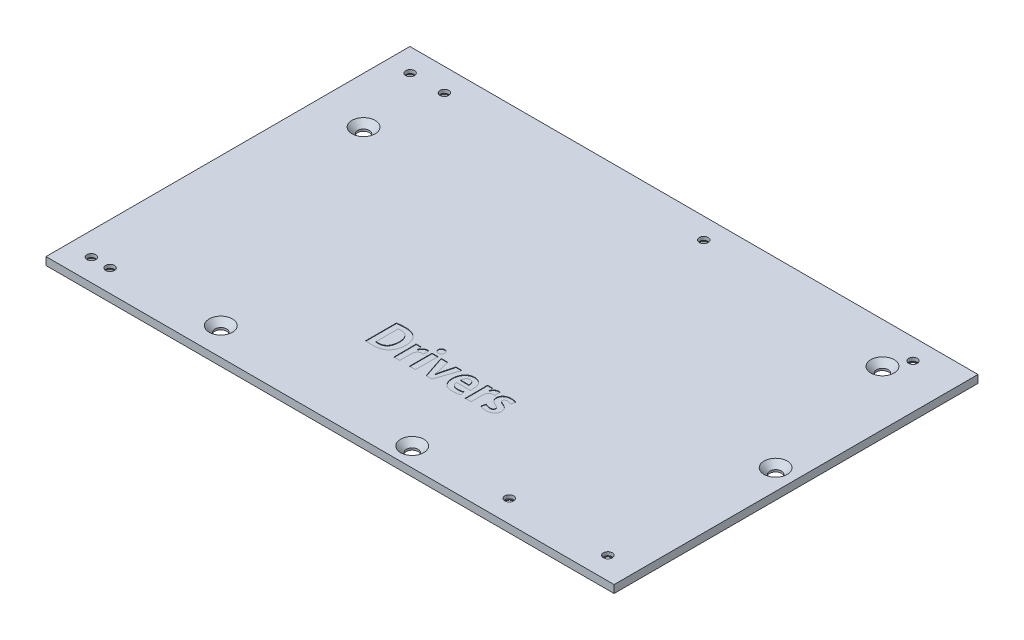
from build123d import *

# Parameters (mm, degrees)
SKETCH2_W                                    = 218.915
SKETCH2_H                                    = 140.238
SKETCH2_R                                    = 1.5
BOSS_EXTRUDE1_DEPTH                          = 3
SKETCH3_W                                    = 2.298644743
SKETCH3_H                                    = 8.669685468
CUT_EXTRUDE2_DEPTH                           = 0.2
CSK_FOR_M4_HEX_SOCKET_COUNTERSUNK_CA_2_COUNT = 2
CSK_FOR_M4_HEX_SOCKET_COUNTERSUNK_CA_2_PITCH = 77.101495492
CSK_FOR_M4_HEX_SOCKET_COUNTERSUNK_CA_3_COUNT = 2
CSK_FOR_M4_HEX_SOCKET_COUNTERSUNK_CA_3_PITCH = 101.438075265
CSK_FOR_M4_HEX_SOCKET_COUNTERSUNK_CA_4_COUNT = 2
CSK_FOR_M4_HEX_SOCKET_COUNTERSUNK_CA_4_PITCH = 181.312778626
CSK_FOR_M4_HEX_SOCKET_COUNTERSUNK_CA_5_COUNT = 2
CSK_FOR_M4_HEX_SOCKET_COUNTERSUNK_CA_5_PITCH = 165.396666202
CSK_FOR_M3_HEX_SOCKET_COUNTERSUNK_CA_2_COUNT = 2
CSK_FOR_M3_HEX_SOCKET_COUNTERSUNK_CA_2_PITCH = 80.645
CSK_FOR_M3_HEX_SOCKET_COUNTERSUNK_CA_3_COUNT = 2
CSK_FOR_M3_HEX_SOCKET_COUNTERSUNK_CA_3_PITCH = 179.704203913
CSK_FOR_M3_HEX_SOCKET_COUNTERSUNK_CA_4_COUNT = 2
CSK_FOR_M3_HEX_SOCKET_COUNTERSUNK_CA_4_PITCH = 192.912053019
CSK_FOR_M3_HEX_SOCKET_COUNTERSUNK_CA_5_COUNT = 2
CSK_FOR_M3_HEX_SOCKET_COUNTERSUNK_CA_5_PITCH = 223.135659815
CSK_FOR_M3_HEX_SOCKET_COUNTERSUNK_CA_6_COUNT = 2
CSK_FOR_M3_HEX_SOCKET_COUNTERSUNK_CA_6_PITCH = 229.163605531
CSK_FOR_M3_HEX_SOCKET_COUNTERSUNK_CA_7_COUNT = 2
CSK_FOR_M3_HEX_SOCKET_COUNTERSUNK_CA_7_PITCH = 127.747015621
CSK_FOR_M3_HEX_SOCKET_COUNTERSUNK_CA_8_COUNT = 2
CSK_FOR_M3_HEX_SOCKET_COUNTERSUNK_CA_8_PITCH = 123.850312878


with BuildPart() as part:
    # Sketch2 → Boss-Extrude1 (new body)
    with BuildSketch(Plane(origin=(0, 0, 0), x_dir=(1, 0, 0), z_dir=(0, 1, 0))):
        Rectangle(SKETCH2_W, SKETCH2_H)
        with Locations(Location((-87.3095, 61.251, 0), (0, 0, 270))):
            Circle(SKETCH2_R, mode=Mode.SUBTRACT)
        with Locations(Location((-100.5175, 61.251, 0), (0, 0, 270))):
            Circle(SKETCH2_R, mode=Mode.SUBTRACT)
        with Locations(Location((11.7475, 62.141, 0), (0, 0, 270))):
            Circle(SKETCH2_R, mode=Mode.SUBTRACT)
        with Locations(Location((92.3925, 62.141, 0), (0, 0, 270))):
            Circle(SKETCH2_R, mode=Mode.SUBTRACT)
        with Locations(Location((60.4925, -61.559, 0), (0, 0, 270))):
            Circle(SKETCH2_R, mode=Mode.SUBTRACT)
        with Locations(Location((98.4925, -61.559, 0), (0, 0, 270))):
            Circle(SKETCH2_R, mode=Mode.SUBTRACT)
        with Locations(Location((-93.3165, -61.559, 0), (0, 0, 270))):
            Circle(SKETCH2_R, mode=Mode.SUBTRACT)
        with Locations(Location((-100.5175, -61.559, 0), (0, 0, 270))):
            Circle(SKETCH2_R, mode=Mode.SUBTRACT)
    extrude(amount=BOSS_EXTRUDE1_DEPTH)

    # Sketch3 → Cut-Extrude2 (cut)
    # profile 1 of 8: a face of its own
    with BuildSketch(Plane(origin=(0, 3, 0), x_dir=(1, 0, 0), z_dir=(0, 1, 0))):
        with BuildLine():
            add(Edge.make_bspline(
                [(-19.773523186, -36.616542613), (-19.692877975, -36.627718187), (-19.522806263, -36.651286219), (-19.25573132, -36.680092345), (-18.964467685, -36.704316718), (-18.650043814, -36.727551671), (-18.312098436, -36.745031954), (-17.950829239, -36.758765798), (-17.566907783, -36.767099749), (-17.302934654, -36.771224044), (-17.167186135, -36.773344968)],
                knots=[0, 0, 0, 0, 0.747798485, 1.577023202, 2.466955376, 3.432305679, 4.472841868, 5.575028817, 6.752955478, 8, 8, 8, 8], degree=3))
            add(Edge.make_bspline(
                [(-17.167186135, -36.773344968), (-16.914385162, -36.769231623), (-16.421404683, -36.761210297), (-15.703937253, -36.692360594), (-15.028021379, -36.581053654), (-14.39671948, -36.420911951), (-13.809487851, -36.217118709), (-13.273107567, -35.961121892), (-12.780095814, -35.666285148), (-12.492354578, -35.424342424), (-12.350444054, -35.305019176)],
                knots=[0, 0, 0, 0, 1.17842423, 2.298013867, 3.356996017, 4.369259479, 5.331192529, 6.249700563, 7.136773321, 8, 8, 8, 8], degree=3))
            add(Edge.make_bspline(
                [(-12.350444054, -35.305019176), (-12.291009989, -35.251375231), (-12.170198305, -35.142333128), (-11.996947178, -34.963094353), (-11.833799267, -34.762640168), (-11.670548315, -34.548605269), (-11.52193997, -34.310900638), (-11.370031425, -34.060409926), (-11.229569923, -33.788861384), (-11.092242535, -33.500083707), (-10.964046665, -33.191119765), (-10.857664358, -32.856576209), (-10.760957933, -32.501605914), (-10.686544786, -32.122398597), (-10.621184629, -31.721288328), (-10.57901856, -31.296556848), (-10.544770288, -30.849283167), (-10.538950359, -30.543401316), (-10.535964416, -30.38646714)],
                knots=[0, 0, 0, 0, 0.711529635, 1.446327024, 2.212730038, 3.007707617, 3.836959069, 4.702581573, 5.611055214, 6.552559085, 7.54462654, 8.581167827, 9.670545423, 10.812911411, 12.014096724, 13.281372547, 14.605194915, 16, 16, 16, 16], degree=3))
            add(Edge.make_bspline(
                [(-10.535964416, -30.38646714), (-10.538011906, -30.252955959), (-10.542017263, -29.991777627), (-10.564308228, -29.607469941), (-10.603487222, -29.238529386), (-10.653815105, -28.884056095), (-10.722820273, -28.545341196), (-10.803723461, -28.222041701), (-10.898002884, -27.913287096), (-11.009692681, -27.620624466), (-11.134506232, -27.342386464), (-11.26971765, -27.076436513), (-11.419718697, -26.825524987), (-11.580235701, -26.586751272), (-11.754055639, -26.362912923), (-11.941544027, -26.154389234), (-12.13731418, -25.955564094), (-12.279344602, -25.835640391), (-12.350444054, -25.775607411)],
                knots=[0, 0, 0, 0, 1.250196122, 2.445668869, 3.60292861, 4.723409941, 5.796680955, 6.837975795, 7.843086112, 8.817515314, 9.76895262, 10.69744629, 11.609358382, 12.504409608, 13.39005195, 14.260302496, 15.129119398, 16, 16, 16, 16], degree=3))
            add(Edge.make_bspline(
                [(-12.350444054, -25.775607411), (-12.478022477, -25.673834773), (-12.735842559, -25.468164966), (-13.168123313, -25.21065108), (-13.638991157, -24.994028484), (-14.150475885, -24.813226886), (-14.708529552, -24.677162854), (-15.316536923, -24.577813729), (-15.97677705, -24.520068229), (-16.434793544, -24.512535519), (-16.671711022, -24.508639085)],
                knots=[0, 0, 0, 0, 0.850789701, 1.719339872, 2.61723906, 3.551911928, 4.545442216, 5.610282156, 6.763874371, 8, 8, 8, 8], degree=3))
            add(Edge.make_bspline(
                [(-16.671711022, -24.508639085), (-16.957619842, -24.511218411), (-17.515564562, -24.516251907), (-18.201827187, -24.560458739), (-18.72440942, -24.607375564), (-19.091390457, -24.654380799), (-19.440278129, -24.702376655), (-19.665789549, -24.742474773), (-19.77578342, -24.762032751)],
                knots=[0, 0, 0, 0, 1.650018419, 3.219974348, 3.967566001, 4.678084243, 5.355231624, 6, 6, 6, 6], degree=3))
            Line((-19.77578342, -24.762032751), (-19.773523186, -36.616542613))
        make_face()
        with BuildLine():
            add(Edge.make_bspline(
                [(-17.474878443, -26.437305835), (-17.406378443, -26.424755637), (-17.255763214, -26.397160733), (-17.006158209, -26.372950406), (-16.714300917, -26.351102696), (-16.505098902, -26.347608369), (-16.393430479, -26.345743158)],
                knots=[0, 0, 0, 0, 0.76869223, 1.690171609, 2.76705349, 4, 4, 4, 4], degree=3))
            add(Edge.make_bspline(
                [(-16.393430479, -26.345743158), (-16.262822839, -26.348645857), (-16.008241503, -26.35430382), (-15.637603811, -26.402275663), (-15.289663326, -26.482495779), (-14.961073349, -26.58793409), (-14.658621154, -26.737249919), (-14.373925416, -26.909325668), (-14.114290469, -27.118793222), (-13.875497375, -27.356563486), (-13.661383871, -27.627933223), (-13.475271367, -27.932490253), (-13.321129629, -28.270182199), (-13.186494999, -28.636642324), (-13.091451193, -29.038247943), (-13.015258486, -29.46933232), (-12.970788235, -29.933076875), (-12.963043213, -30.252892009), (-12.959041339, -30.418141348)],
                knots=[0, 0, 0, 0, 1.034636826, 2.016721417, 2.954616098, 3.861659027, 4.743652532, 5.62095741, 6.492606741, 7.379948462, 8.28614458, 9.224914536, 10.200706863, 11.223314941, 12.31319917, 13.465574242, 14.690455408, 16, 16, 16, 16], degree=3))
            add(Edge.make_bspline(
                [(-12.959041339, -30.418141348), (-12.963586993, -30.608289612), (-12.972369525, -30.975669764), (-13.021555536, -31.507246386), (-13.103160939, -31.99835502), (-13.209673435, -32.451808795), (-13.34982481, -32.864735442), (-13.519158035, -33.239658321), (-13.720873969, -33.573564213), (-13.951345508, -33.868863005), (-14.208041835, -34.124809882), (-14.486178225, -34.345844089), (-14.784267569, -34.53371057), (-15.106282871, -34.683259032), (-15.448733003, -34.798084151), (-15.811611775, -34.880353041), (-16.196167513, -34.925669376), (-16.459678485, -34.928170942), (-16.594787945, -34.929453565)],
                knots=[0, 0, 0, 0, 1.382790342, 2.671650606, 3.877892401, 5.000458499, 6.054825918, 7.043745429, 7.986092149, 8.88452668, 9.760866288, 10.615577842, 11.46308158, 12.316807429, 13.190810493, 14.084799087, 15.018022824, 16, 16, 16, 16], degree=3))
            add(Edge.make_bspline(
                [(-16.594787945, -34.929453565), (-16.675494433, -34.931177238), (-16.831684566, -34.934513037), (-17.05876175, -34.923515129), (-17.271850594, -34.909690472), (-17.408591602, -34.891001807), (-17.474878443, -34.881942253)],
                knots=[0, 0, 0, 0, 1.0974001, 2.123783006, 3.090481336, 4, 4, 4, 4], degree=3))
            Line((-17.474878443, -34.881942253), (-17.474878443, -26.437305835))
        make_face(mode=Mode.SUBTRACT)
    # profile 2 of 8: a face of its own
    with BuildSketch(Plane(origin=(0, 3, 0), x_dir=(1, 0, 0), z_dir=(0, 1, 0))):
        with BuildLine():
            Line((-6.910140303, -29.477541535), (-7.00333353, -27.967915103))
            Line((-7.00333353, -27.967915103), (-8.976347706, -27.967915103))
            add(Edge.make_bspline(
                [(-8.976347706, -27.967915103), (-8.967807583, -28.166237182), (-8.949952024, -28.580885961), (-8.932429902, -29.231030361), (-8.921707799, -29.936210261), (-8.917985113, -30.424925331), (-8.916054914, -30.678322343)],
                knots=[0, 0, 0, 0, 0.878570808, 1.836902451, 2.878441676, 4, 4, 4, 4], degree=3))
            Line((-8.916054914, -30.678322343), (-8.91379468, -36.637600571))
            Line((-8.91379468, -36.637600571), (-6.615149936, -36.637600571))
            Line((-6.615149936, -36.637600571), (-6.615149936, -32.154781001))
            add(Edge.make_bspline(
                [(-6.615149936, -32.154781001), (-6.612567299, -32.06603014), (-6.607534868, -31.893093516), (-6.580570195, -31.643031511), (-6.53756993, -31.410055187), (-6.479656664, -31.194647687), (-6.404326872, -30.997402066), (-6.317121503, -30.815984137), (-6.209631737, -30.655335133), (-6.088897361, -30.511200992), (-5.955754651, -30.385775884), (-5.813839618, -30.275036985), (-5.662670429, -30.18269562), (-5.501818697, -30.10704936), (-5.332108459, -30.047786128), (-5.152773536, -30.008415697), (-4.96513153, -29.981622776), (-4.836969137, -29.980039228), (-4.771258534, -29.979227321)],
                knots=[0, 0, 0, 0, 1.320531847, 2.573139202, 3.737200453, 4.842238086, 5.886183057, 6.874635172, 7.829930864, 8.753606734, 9.666246489, 10.545948826, 11.42722372, 12.29547608, 13.186057347, 14.095104019, 15.023333894, 16, 16, 16, 16], degree=3))
            add(Edge.make_bspline(
                [(-4.771258534, -29.979227321), (-4.663932339, -29.97927829), (-4.464392632, -29.979373051), (-4.267312688, -30.010220584), (-4.176235909, -30.024476189)],
                knots=[0, 0, 0, 0, 1.075737725, 2, 2, 2, 2], degree=3))
            Line((-4.176235909, -30.024476189), (-4.175581922, -27.823118723))
            add(Edge.make_bspline(
                [(-4.175581922, -27.823118723), (-4.254226195, -27.826187901), (-4.426352232, -27.832905304), (-4.598551486, -27.828029318), (-4.692073013, -27.825381167)],
                knots=[0, 0, 0, 0, 0.913798691, 2, 2, 2, 2], degree=3))
            add(Edge.make_bspline(
                [(-4.692073013, -27.825381167), (-4.797309999, -27.824923275), (-5.008823265, -27.824002968), (-5.323062876, -27.900571031), (-5.63331425, -28.026632515), (-5.934312443, -28.210237683), (-6.218591484, -28.446663805), (-6.465875945, -28.742948366), (-6.685024841, -29.086945377), (-6.792480229, -29.345303083), (-6.848181611, -29.479227321)],
                knots=[0, 0, 0, 0, 0.866819651, 1.742199811, 2.650674065, 3.626487561, 4.643864205, 5.691614162, 6.803407804, 8, 8, 8, 8], degree=3))
            Line((-6.848181611, -29.479227321), (-6.910140303, -29.477541535))
        make_face()
    # profile 3 of 8: a face of its own
    with BuildSketch(Plane(origin=(0, 3, 0), x_dir=(1, 0, 0), z_dir=(0, 1, 0))):
        with BuildLine():
            add(Edge.make_bspline(
                [(-0.388905592, -25.569815644), (-0.394259293, -25.483437705), (-0.404600745, -25.316586149), (-0.467899937, -25.078654517), (-0.576592287, -24.868996254), (-0.723204659, -24.68856952), (-0.902804026, -24.539255263), (-1.116243654, -24.431870706), (-1.358574959, -24.364836616), (-1.530231343, -24.355258716), (-1.619674823, -24.350268045)],
                knots=[0, 0, 0, 0, 1.067678627, 2.062376614, 3.016841452, 3.964320136, 4.917692493, 5.880446744, 6.895583054, 8, 8, 8, 8], degree=3))
            add(Edge.make_bspline(
                [(-1.619674823, -24.350268045), (-1.705368303, -24.35532102), (-1.871100673, -24.365093544), (-2.106325688, -24.432783306), (-2.316804828, -24.539713645), (-2.495380587, -24.689378459), (-2.64573226, -24.867475824), (-2.74912825, -25.080207675), (-2.820846835, -25.316320096), (-2.82990847, -25.484688216), (-2.83460695, -25.571987502)],
                knots=[0, 0, 0, 0, 1.066831069, 2.06326596, 3.025668899, 3.98697027, 4.948271641, 5.90639895, 6.914462685, 8, 8, 8, 8], degree=3))
            add(Edge.make_bspline(
                [(-2.83460695, -25.571987502), (-2.829275482, -25.656859798), (-2.81893306, -25.821502092), (-2.754666743, -26.056289662), (-2.649049038, -26.266802451), (-2.50261031, -26.448556623), (-2.323510374, -26.599257612), (-2.11316625, -26.710037688), (-1.874609087, -26.77605133), (-1.706818409, -26.787671776), (-1.619674823, -26.793706959)],
                knots=[0, 0, 0, 0, 1.057718482, 2.051849729, 3.010193927, 3.97308998, 4.940607778, 5.907577615, 6.913281758, 8, 8, 8, 8], degree=3))
            add(Edge.make_bspline(
                [(-1.619674823, -26.793706959), (-1.533303063, -26.789337671), (-1.366370926, -26.780893076), (-1.129011428, -26.716618964), (-0.918691152, -26.609439958), (-0.733396684, -26.467248671), (-0.583623243, -26.28687097), (-0.471548761, -26.075643017), (-0.406551526, -25.832814344), (-0.394952015, -25.661360468), (-0.388905592, -25.571987502)],
                knots=[0, 0, 0, 0, 1.065625004, 2.059551157, 3.009038306, 3.964579149, 4.923155116, 5.881188186, 6.895536802, 8, 8, 8, 8], degree=3))
            Line((-0.388905592, -25.571987502), (-0.388905592, -25.569815644))
        make_face()
    # profile 4 of 8: a face of its own
    with BuildSketch(Plane(origin=(0, 3, 0), x_dir=(1, 0, 0), z_dir=(0, 1, 0))):
        with Locations((-1.683024344, -32.302757837)):
            Rectangle(SKETCH3_W, SKETCH3_H)
    # profile 5 of 8: a face of its own
    with BuildSketch(Plane(origin=(0, 3, 0), x_dir=(1, 0, 0), z_dir=(0, 1, 0))):
        with BuildLine():
            add(Edge.make_bspline(
                [(5.263707707, -32.170346346), (5.174544252, -32.532857608), (4.996559536, -33.25648888), (4.852612705, -33.987651863), (4.780777666, -34.352530488)],
                knots=[0, 0, 0, 0, 1.001922598, 2, 2, 2, 2], degree=3))
            Line((4.780777666, -34.352530488), (4.734711312, -34.352530488))
            add(Edge.make_bspline(
                [(4.734711312, -34.352530488), (4.662135966, -33.985450573), (4.51653432, -33.249009854), (4.339937691, -32.519380193), (4.251365901, -32.153435465)],
                knots=[0, 0, 0, 0, 0.99690282, 2, 2, 2, 2], degree=3))
            Line((4.251365901, -32.153435465), (3.116604695, -27.967915103))
            Line((3.116604695, -27.967915103), (0.642768616, -27.967915103))
            Line((0.642768616, -27.967915103), (3.552248784, -36.624023701))
            Line((3.552248784, -36.624023701), (5.777145383, -36.624023701))
            Line((5.777145383, -36.624023701), (8.733264144, -27.967915103))
            Line((8.733264144, -27.967915103), (6.35281793, -27.967915103))
            Line((6.35281793, -27.967915103), (5.263707707, -32.170346346))
        make_face()
    # profile 6 of 8: a face of its own
    with BuildSketch(Plane(origin=(0, 3, 0), x_dir=(1, 0, 0), z_dir=(0, 1, 0))):
        with BuildLine():
            add(Edge.make_bspline(
                [(16.918402277, -33.017691069), (16.928189436, -32.952156016), (16.948718864, -32.814690472), (16.968262665, -32.597969584), (16.979679358, -32.36321716), (16.979806885, -32.2009608), (16.979872688, -32.11723637)],
                knots=[0, 0, 0, 0, 0.879814102, 1.845487553, 2.888269607, 4, 4, 4, 4], degree=3))
            add(Edge.make_bspline(
                [(16.979872688, -32.11723637), (16.976119543, -31.945925705), (16.968829845, -31.613190649), (16.920591889, -31.130159003), (16.845341941, -30.679099292), (16.738515355, -30.260848974), (16.605919819, -29.873945323), (16.443556394, -29.519082674), (16.249761599, -29.198064239), (16.030366684, -28.909066899), (15.783806811, -28.6547821), (15.517021585, -28.430448879), (15.224500694, -28.246203029), (14.914790428, -28.088182308), (14.579747264, -27.973169987), (14.225004441, -27.885368471), (13.84773613, -27.836559436), (13.589354275, -27.829162889), (13.457248254, -27.825381167)],
                knots=[0, 0, 0, 0, 1.306657607, 2.537908493, 3.699270234, 4.791739878, 5.826909547, 6.815290999, 7.762398175, 8.68170366, 9.57675071, 10.459137333, 11.333612719, 12.208315133, 13.105301175, 14.028952094, 14.992238463, 16, 16, 16, 16], degree=3))
            add(Edge.make_bspline(
                [(13.457248254, -27.825381167), (13.300111528, -27.833746026), (12.994075403, -27.850037246), (12.549666901, -27.923141971), (12.134174481, -28.036077491), (11.746100423, -28.18729889), (11.388847763, -28.381266962), (11.059663698, -28.61325228), (10.761842986, -28.887713915), (10.493999923, -29.198181248), (10.254706306, -29.536311931), (10.049631485, -29.898432442), (9.870578107, -30.276928095), (9.729880054, -30.677283391), (9.615600762, -31.094403732), (9.535097821, -31.530318301), (9.483894714, -31.984803058), (9.476734695, -32.294321722), (9.473085358, -32.452077999)],
                knots=[0, 0, 0, 0, 1.102218766, 2.14665769, 3.149339139, 4.115122672, 5.058741015, 5.991431174, 6.93040496, 7.889527187, 8.860316271, 9.828598601, 10.80279168, 11.790822775, 12.798603709, 13.831085196, 14.894541863, 16, 16, 16, 16], degree=3))
            add(Edge.make_bspline(
                [(9.473085358, -32.452077999), (9.476217732, -32.615912166), (9.482313122, -32.934722483), (9.539539249, -33.398878983), (9.623065534, -33.836940738), (9.744166177, -34.247705858), (9.893736511, -34.633084918), (10.084655779, -34.987702777), (10.303853411, -35.318233213), (10.558024322, -35.619595717), (10.843492743, -35.890981573), (11.163256094, -36.124288989), (11.510981573, -36.324945345), (11.890283835, -36.487789611), (12.29870792, -36.617022179), (12.738439374, -36.708122707), (13.207497116, -36.76850388), (13.530960597, -36.7776817), (13.697067258, -36.782394741)],
                knots=[0, 0, 0, 0, 1.145056205, 2.228202694, 3.265464393, 4.259985655, 5.218630789, 6.1504322, 7.070355583, 7.987236137, 8.901139799, 9.817656355, 10.748382851, 11.702521477, 12.69814653, 13.738580065, 14.838703788, 16, 16, 16, 16], degree=3))
            add(Edge.make_bspline(
                [(13.697067258, -36.782394741), (13.834362502, -36.780561917), (14.104653716, -36.77695366), (14.503929395, -36.751246867), (14.88978511, -36.71149055), (15.260247633, -36.65439855), (15.613407546, -36.585886651), (15.943780781, -36.499651921), (16.252758955, -36.40347907), (16.446405193, -36.325160817), (16.540958661, -36.286919628)],
                knots=[0, 0, 0, 0, 1.134244074, 2.232970358, 3.304290349, 4.337913843, 5.328893587, 6.274899807, 7.157669119, 8, 8, 8, 8], degree=3))
            Line((16.540958661, -36.286919628), (16.214680734, -34.709254187))
            add(Edge.make_bspline(
                [(16.214680734, -34.709254187), (16.063451137, -34.761173166), (15.748092141, -34.869439785), (15.234204296, -34.969539678), (14.669611567, -35.041705983), (14.274248983, -35.055661407), (14.068107982, -35.062937728)],
                knots=[0, 0, 0, 0, 0.87704573, 1.828902987, 2.867995791, 4, 4, 4, 4], degree=3))
            add(Edge.make_bspline(
                [(14.068107982, -35.062937728), (13.98736869, -35.062601527), (13.828625884, -35.061940516), (13.595003007, -35.040893477), (13.370241742, -35.00535856), (13.155203904, -34.952214582), (12.948032858, -34.888704354), (12.752901226, -34.802221919), (12.564680871, -34.706561543), (12.387459748, -34.593085987), (12.223811185, -34.463122154), (12.080508593, -34.311515539), (11.953959314, -34.143243622), (11.851594987, -33.953841177), (11.762951156, -33.747868562), (11.700279944, -33.521496478), (11.650538854, -33.277425796), (11.63646644, -33.107676219), (11.629193955, -33.019951303)],
                knots=[0, 0, 0, 0, 1.082387839, 2.128099923, 3.142379076, 4.130968346, 5.096948731, 6.043838086, 6.989267902, 7.926329474, 8.861424035, 9.784240628, 10.716760901, 11.676526397, 12.664598162, 13.717669873, 14.820514169, 16, 16, 16, 16], degree=3))
            Line((11.629193955, -33.019951303), (16.918402277, -33.017691069))
        make_face()
        with BuildLine():
            add(Edge.make_bspline(
                [(11.629193955, -31.443028226), (11.640668798, -31.327213873), (11.663732567, -31.094433722), (11.750854707, -30.750537416), (11.888298769, -30.415897749), (12.031584887, -30.144852433), (12.169487965, -29.940150822), (12.291318297, -29.804783989), (12.427228032, -29.688618834), (12.578158005, -29.593816265), (12.740980638, -29.515164043), (12.919056847, -29.457073283), (13.110884515, -29.415457618), (13.244368539, -29.405248796), (13.312451874, -29.4000418)],
                knots=[0, 0, 0, 0, 1.434019087, 2.882295425, 4.35559367, 5.887023456, 6.655881304, 7.39355732, 8.125995891, 8.853635031, 9.585837332, 10.350577125, 11.158714241, 12, 12, 12, 12], degree=3))
            add(Edge.make_bspline(
                [(13.312451874, -29.4000418), (13.381973348, -29.405617553), (13.516544143, -29.416410382), (13.710424521, -29.451996646), (13.888297422, -29.507652411), (14.047497766, -29.586403051), (14.193133279, -29.67896071), (14.320042095, -29.793896471), (14.432526384, -29.925480533), (14.553724358, -30.126845241), (14.672972868, -30.396322113), (14.780871876, -30.733276701), (14.834852023, -31.085273644), (14.836504212, -31.322966699), (14.837338751, -31.443028226)],
                knots=[0, 0, 0, 0, 0.873766243, 1.691325154, 2.465551819, 3.201135629, 3.9116346, 4.62125276, 5.338946048, 6.073375047, 7.558144449, 9.023104326, 10.496335382, 12, 12, 12, 12], degree=3))
            Line((14.837338751, -31.443028226), (11.629193955, -31.443028226))
        make_face(mode=Mode.SUBTRACT)
    # profile 7 of 8: a face of its own
    with BuildSketch(Plane(origin=(0, 3, 0), x_dir=(1, 0, 0), z_dir=(0, 1, 0))):
        with BuildLine():
            Line((20.601171914, -29.477541535), (20.507978687, -27.967915103))
            Line((20.507978687, -27.967915103), (18.534964512, -27.967915103))
            add(Edge.make_bspline(
                [(18.534964512, -27.967915103), (18.543504635, -28.166237182), (18.561360194, -28.580885961), (18.578882315, -29.231030361), (18.589604418, -29.936210261), (18.593327104, -30.424925331), (18.595257304, -30.678322343)],
                knots=[0, 0, 0, 0, 0.878570808, 1.836902451, 2.878441676, 4, 4, 4, 4], degree=3))
            Line((18.595257304, -30.678322343), (18.597517538, -36.637600571))
            Line((18.597517538, -36.637600571), (20.896162281, -36.637600571))
            Line((20.896162281, -36.637600571), (20.896162281, -32.154781001))
            add(Edge.make_bspline(
                [(20.896162281, -32.154781001), (20.898744918, -32.06603014), (20.903777349, -31.893093516), (20.930742022, -31.643031511), (20.973742287, -31.410055187), (21.031655553, -31.194647687), (21.106985345, -30.997402066), (21.194190714, -30.815984137), (21.30168048, -30.655335133), (21.422414856, -30.511200992), (21.555557566, -30.385775884), (21.6974726, -30.275036985), (21.848641788, -30.18269562), (22.00949352, -30.10704936), (22.179203758, -30.047786128), (22.358538681, -30.008415697), (22.546180688, -29.981622776), (22.67434308, -29.980039228), (22.740053684, -29.979227321)],
                knots=[0, 0, 0, 0, 1.320531847, 2.573139202, 3.737200453, 4.842238086, 5.886183057, 6.874635172, 7.829930864, 8.753606734, 9.666246489, 10.545948826, 11.42722372, 12.29547608, 13.186057347, 14.095104019, 15.023333894, 16, 16, 16, 16], degree=3))
            add(Edge.make_bspline(
                [(22.740053684, -29.979227321), (22.847379878, -29.97927829), (23.046919585, -29.979373051), (23.243999529, -30.010220584), (23.335076308, -30.024476189)],
                knots=[0, 0, 0, 0, 1.075737725, 2, 2, 2, 2], degree=3))
            Line((23.335076308, -30.024476189), (23.335730296, -27.823118723))
            add(Edge.make_bspline(
                [(23.335730296, -27.823118723), (23.257086022, -27.826187901), (23.084959985, -27.832905304), (22.912760731, -27.828029318), (22.819239204, -27.825381167)],
                knots=[0, 0, 0, 0, 0.913798691, 2, 2, 2, 2], degree=3))
            add(Edge.make_bspline(
                [(22.819239204, -27.825381167), (22.714002219, -27.824923275), (22.502488952, -27.824002968), (22.188249342, -27.900571031), (21.877997968, -28.026632515), (21.576999775, -28.210237683), (21.292720733, -28.446663805), (21.045436273, -28.742948366), (20.826287377, -29.086945377), (20.718831988, -29.345303083), (20.663130607, -29.479227321)],
                knots=[0, 0, 0, 0, 0.866819651, 1.742199811, 2.650674065, 3.626487561, 4.643864205, 5.691614162, 6.803407804, 8, 8, 8, 8], degree=3))
            Line((20.663130607, -29.479227321), (20.601171914, -29.477541535))
        make_face()
    # profile 8 of 8: a face of its own
    with BuildSketch(Plane(origin=(0, 3, 0), x_dir=(1, 0, 0), z_dir=(0, 1, 0))):
        with BuildLine():
            add(Edge.make_bspline(
                [(24.186075407, -36.183664715), (24.261978717, -36.228195155), (24.418694754, -36.320136259), (24.678502661, -36.426147782), (24.958310843, -36.528395728), (25.26125954, -36.611745936), (25.581123352, -36.682697082), (25.913798948, -36.731707941), (26.256857784, -36.76149949), (26.488862308, -36.76635609), (26.606569521, -36.768820081)],
                knots=[0, 0, 0, 0, 0.83761196, 1.729400559, 2.668252281, 3.676193025, 4.720774259, 5.789020092, 6.87826204, 8, 8, 8, 8], degree=3))
            add(Edge.make_bspline(
                [(26.606569521, -36.768820081), (26.740152556, -36.765307164), (26.999573731, -36.758485001), (27.37675265, -36.719344303), (27.730049613, -36.65929521), (28.059461608, -36.576058189), (28.364664535, -36.469433525), (28.646331621, -36.340951145), (28.90375376, -36.188926572), (29.13579966, -36.014054858), (29.340606049, -35.819220409), (29.522829292, -35.610698645), (29.671715727, -35.381561243), (29.797482993, -35.138781396), (29.895428243, -34.878325554), (29.964461711, -34.601977075), (30.008965257, -34.309451601), (30.015158553, -34.109105875), (30.018334227, -34.006376642)],
                knots=[0, 0, 0, 0, 1.294448016, 2.513846346, 3.670773034, 4.764320961, 5.802019244, 6.79930617, 7.759297293, 8.693207164, 9.608170021, 10.494314425, 11.369880064, 12.249036721, 13.139389433, 14.05924175, 15.004857203, 16, 16, 16, 16], degree=3))
            add(Edge.make_bspline(
                [(30.018334227, -34.006376642), (30.018145025, -33.933926905), (30.017773476, -33.791652371), (29.994532109, -33.581012752), (29.952360353, -33.378226828), (29.900926388, -33.179711724), (29.822593529, -32.991802497), (29.736642293, -32.807520541), (29.628682828, -32.63225729), (29.502898561, -32.464881238), (29.363595588, -32.301840026), (29.205895729, -32.147017015), (29.031208926, -32.000571042), (28.840426796, -31.859416469), (28.631952081, -31.726761264), (28.407114687, -31.599506987), (28.165228366, -31.479815502), (27.996074281, -31.407526705), (27.909736942, -31.370630036)],
                knots=[0, 0, 0, 0, 0.962486949, 1.890101854, 2.810103424, 3.714741646, 4.610057768, 5.511190598, 6.415440003, 7.339636668, 8.292049338, 9.263110372, 10.273172223, 11.319680428, 12.415205866, 13.555314351, 14.752216631, 16, 16, 16, 16], degree=3))
            add(Edge.make_bspline(
                [(27.909736942, -31.370630036), (27.791678355, -31.3218454), (27.573236018, -31.231579796), (27.275769252, -31.092127022), (27.036571279, -30.956869489), (26.844842572, -30.831245175), (26.704923308, -30.695314799), (26.605725663, -30.5501655), (26.547837328, -30.389168192), (26.544768097, -30.277561974), (26.543221104, -30.221308769)],
                knots=[0, 0, 0, 0, 1.614286799, 2.986894832, 4.147698299, 5.086165248, 5.874638583, 6.596229827, 7.29245366, 8, 8, 8, 8], degree=3))
            add(Edge.make_bspline(
                [(26.543221104, -30.221308769), (26.546764198, -30.164365371), (26.553723879, -30.052511746), (26.606993826, -29.892585575), (26.698968109, -29.750794165), (26.825244893, -29.627347527), (26.98697032, -29.528088963), (27.180137521, -29.451915166), (27.407429566, -29.412020591), (27.56873047, -29.4041869), (27.654080833, -29.4000418)],
                knots=[0, 0, 0, 0, 0.881322943, 1.731178161, 2.577168917, 3.477799905, 4.443891127, 5.498430146, 6.676325488, 8, 8, 8, 8], degree=3))
            add(Edge.make_bspline(
                [(27.654080833, -29.4000418), (27.734808171, -29.403774144), (27.894396169, -29.411152528), (28.128902297, -29.435709065), (28.35254313, -29.486319968), (28.566153537, -29.545209708), (28.764804816, -29.620133994), (28.95075712, -29.689567354), (29.117021083, -29.767594427), (29.219937574, -29.823408091), (29.269465448, -29.850268045)],
                knots=[0, 0, 0, 0, 1.145139439, 2.263799542, 3.334746207, 4.390066399, 5.400675127, 6.341237668, 7.2017317, 8, 8, 8, 8], degree=3))
            Line((29.269465448, -29.850268045), (29.697595309, -28.28357457))
            add(Edge.make_bspline(
                [(29.697595309, -28.28357457), (29.632141682, -28.252279192), (29.496428958, -28.187390793), (29.278267097, -28.101077565), (29.038010788, -28.025890825), (28.779102359, -27.954660587), (28.501005912, -27.898381929), (28.205435829, -27.858941499), (27.894459605, -27.830045132), (27.681300157, -27.826955991), (27.572632869, -27.825381167)],
                knots=[0, 0, 0, 0, 0.793946833, 1.646183613, 2.565050018, 3.548181603, 4.584222958, 5.667522799, 6.810918423, 8, 8, 8, 8], degree=3))
            add(Edge.make_bspline(
                [(27.572632869, -27.825381167), (27.452589415, -27.828688156), (27.217846398, -27.83515492), (26.876329942, -27.877754823), (26.554795203, -27.937636885), (26.252268826, -28.019122127), (25.970109406, -28.124552374), (25.708483487, -28.254570108), (25.4663617, -28.404748263), (25.245207512, -28.575611008), (25.04836816, -28.766328496), (24.875266186, -28.970770459), (24.726845706, -29.188554498), (24.60618993, -29.422002952), (24.510970111, -29.668501073), (24.443250578, -29.929682947), (24.399585708, -30.203304505), (24.391312053, -30.390830251), (24.387112507, -30.486014651)],
                knots=[0, 0, 0, 0, 1.238305518, 2.421486237, 3.5461187, 4.61066152, 5.649707088, 6.648348897, 7.619889882, 8.584803378, 9.525735187, 10.442256057, 11.344296488, 12.23865353, 13.147513515, 14.064694656, 15.017676866, 16, 16, 16, 16], degree=3))
            add(Edge.make_bspline(
                [(24.387112507, -30.486014651), (24.391608895, -30.605009586), (24.400593592, -30.842785684), (24.497457804, -31.194494807), (24.655452714, -31.535538211), (24.838483788, -31.807866659), (25.017719565, -32.017894004), (25.178737351, -32.171514781), (25.356660158, -32.324418581), (25.560563742, -32.468288729), (25.782821884, -32.610317656), (26.02708333, -32.746464264), (26.292022401, -32.878043546), (26.478707527, -32.958259027), (26.574895313, -32.999589312)],
                knots=[0, 0, 0, 0, 1.205031059, 2.40789731, 3.671482689, 5.006580914, 5.722947508, 6.46981472, 7.262559811, 8.101501413, 8.999551731, 9.938382947, 10.93777087, 12, 12, 12, 12], degree=3))
            add(Edge.make_bspline(
                [(26.574895313, -32.999589312), (26.687116229, -33.045705391), (26.896059555, -33.13156859), (27.177943279, -33.271200653), (27.406142132, -33.408091152), (27.585932624, -33.544180134), (27.715226644, -33.692115064), (27.808081015, -33.849896635), (27.859238047, -34.025093231), (27.861221379, -34.146340905), (27.862225629, -34.207734108)],
                knots=[0, 0, 0, 0, 1.539706787, 2.866769117, 3.98803217, 4.914911995, 5.715441686, 6.465811877, 7.223170887, 8, 8, 8, 8], degree=3))
            add(Edge.make_bspline(
                [(27.862225629, -34.207734108), (27.859290915, -34.271555353), (27.853639597, -34.394454598), (27.794068764, -34.569123165), (27.694404404, -34.72050319), (27.556647756, -34.850959062), (27.378452312, -34.952949069), (27.160628654, -35.023515445), (26.904786731, -35.068719299), (26.720663354, -35.073800712), (26.622406625, -35.076512389)],
                knots=[0, 0, 0, 0, 0.894036243, 1.721627017, 2.5562417, 3.418119501, 4.363067525, 5.415159204, 6.6206097, 8, 8, 8, 8], degree=3))
            add(Edge.make_bspline(
                [(26.622406625, -35.076512389), (26.530278435, -35.072711308), (26.346133173, -35.065113733), (26.070310335, -35.026896708), (25.79383993, -34.971635113), (25.523007658, -34.891568481), (25.264071778, -34.803068712), (25.026333566, -34.706827026), (24.810608242, -34.612632214), (24.679961837, -34.53906948), (24.617881738, -34.504114198)],
                knots=[0, 0, 0, 0, 1.050969077, 2.100670569, 3.171717012, 4.263284762, 5.318573269, 6.291174241, 7.188006187, 8, 8, 8, 8], degree=3))
            Line((24.617881738, -34.504114198), (24.186075407, -36.183664715))
        make_face()
    extrude(amount=-CUT_EXTRUDE2_DEPTH, mode=Mode.SUBTRACT)

    # Sketch7 → CSK for M4 Hex Socket Countersunk Cap Screw1 (revolve, cut)
    with BuildSketch(Plane(origin=(-52.730872116, 3, 59.478034369), x_dir=(0, 0, 1), z_dir=(1, 0, 0))):
        Polygon((0, 0), (0, 3), (2.25, 3), (2.25, 2.23), (4.48, 0), align=None)
    csk_for_m4_hex_socket_countersunk_cap_sc = revolve(axis=Axis((-52.730872116, 9.35, 59.478034369), (0, -1, 0)), mode=Mode.SUBTRACT)

    # CSK for M4 Hex Socket Countersunk Ca 2: CSK for M4 Hex Socket Countersunk Cap Screw1 ×2
    with Locations(*[Vector(0.9990897631342925, 0, 0.04265729949566903) * (i * CSK_FOR_M4_HEX_SOCKET_COUNTERSUNK_CA_2_PITCH) for i in range(1, CSK_FOR_M4_HEX_SOCKET_COUNTERSUNK_CA_2_COUNT)]):
        add(csk_for_m4_hex_socket_countersunk_cap_sc, mode=Mode.SUBTRACT)

    # CSK for M4 Hex Socket Countersunk Ca 3: CSK for M4 Hex Socket Countersunk Cap Screw1 ×2
    with Locations(*[Vector(-0.3819702192032774, 0, -0.9241746326543486) * (i * CSK_FOR_M4_HEX_SOCKET_COUNTERSUNK_CA_3_PITCH) for i in range(1, CSK_FOR_M4_HEX_SOCKET_COUNTERSUNK_CA_3_COUNT)]):
        add(csk_for_m4_hex_socket_countersunk_cap_sc, mode=Mode.SUBTRACT)

    # CSK for M4 Hex Socket Countersunk Ca 4: CSK for M4 Hex Socket Countersunk Cap Screw1 ×2
    with Locations(*[Vector(0.778075365170597, 0, -0.6281709370184537) * (i * CSK_FOR_M4_HEX_SOCKET_COUNTERSUNK_CA_4_PITCH) for i in range(1, CSK_FOR_M4_HEX_SOCKET_COUNTERSUNK_CA_4_COUNT)]):
        add(csk_for_m4_hex_socket_countersunk_cap_sc, mode=Mode.SUBTRACT)

    # CSK for M4 Hex Socket Countersunk Ca 5: CSK for M4 Hex Socket Countersunk Cap Screw1 ×2
    with Locations(*[Vector(0.9331033071524756, 0, -0.35960842340122223) * (i * CSK_FOR_M4_HEX_SOCKET_COUNTERSUNK_CA_5_PITCH) for i in range(1, CSK_FOR_M4_HEX_SOCKET_COUNTERSUNK_CA_5_COUNT)]):
        add(csk_for_m4_hex_socket_countersunk_cap_sc, mode=Mode.SUBTRACT)

    # Sketch12 → CSK for M3 Hex Socket Countersunk Cap Screw1 (revolve, cut)
    with BuildSketch(Plane(origin=(92.3925, 0, -62.141), x_dir=(0, 0, -1), z_dir=(1, 0, 0))):
        Polygon((0, 0), (0, 3), (1.7, 3), (1.7, 1.66), (3.36, 0), align=None)
    csk_for_m3_hex_socket_countersunk_cap_sc = revolve(axis=Axis((92.3925, -6.35, -62.141), (0, 1, 0)), mode=Mode.SUBTRACT)

    # CSK for M3 Hex Socket Countersunk Ca 2: CSK for M3 Hex Socket Countersunk Cap Screw1 ×2
    with Locations(*[(-i * CSK_FOR_M3_HEX_SOCKET_COUNTERSUNK_CA_2_PITCH, 0, 0) for i in range(1, CSK_FOR_M3_HEX_SOCKET_COUNTERSUNK_CA_2_COUNT)]):
        add(csk_for_m3_hex_socket_countersunk_cap_sc, mode=Mode.SUBTRACT)

    # CSK for M3 Hex Socket Countersunk Ca 3: CSK for M3 Hex Socket Countersunk Cap Screw1 ×2
    with Locations(*[Vector(-0.9999877358852055, 0, 0.0049525830816453545) * (i * CSK_FOR_M3_HEX_SOCKET_COUNTERSUNK_CA_3_PITCH) for i in range(1, CSK_FOR_M3_HEX_SOCKET_COUNTERSUNK_CA_3_COUNT)]):
        add(csk_for_m3_hex_socket_countersunk_cap_sc, mode=Mode.SUBTRACT)

    # CSK for M3 Hex Socket Countersunk Ca 4: CSK for M3 Hex Socket Countersunk Cap Screw1 ×2
    with Locations(*[Vector(-0.9999893577464254, 0, 0.004613501261698819) * (i * CSK_FOR_M3_HEX_SOCKET_COUNTERSUNK_CA_4_PITCH) for i in range(1, CSK_FOR_M3_HEX_SOCKET_COUNTERSUNK_CA_4_COUNT)]):
        add(csk_for_m3_hex_socket_countersunk_cap_sc, mode=Mode.SUBTRACT)

    # CSK for M3 Hex Socket Countersunk Ca 5: CSK for M3 Hex Socket Countersunk Cap Screw1 ×2
    with Locations(*[Vector(-0.8322694819560015, 0, 0.5543712739714145) * (i * CSK_FOR_M3_HEX_SOCKET_COUNTERSUNK_CA_5_PITCH) for i in range(1, CSK_FOR_M3_HEX_SOCKET_COUNTERSUNK_CA_5_COUNT)]):
        add(csk_for_m3_hex_socket_countersunk_cap_sc, mode=Mode.SUBTRACT)

    # CSK for M3 Hex Socket Countersunk Ca 6: CSK for M3 Hex Socket Countersunk Cap Screw1 ×2
    with Locations(*[Vector(-0.8418003354107858, 0, 0.5397890285123333) * (i * CSK_FOR_M3_HEX_SOCKET_COUNTERSUNK_CA_6_PITCH) for i in range(1, CSK_FOR_M3_HEX_SOCKET_COUNTERSUNK_CA_6_COUNT)]):
        add(csk_for_m3_hex_socket_countersunk_cap_sc, mode=Mode.SUBTRACT)

    # CSK for M3 Hex Socket Countersunk Ca 7: CSK for M3 Hex Socket Countersunk Cap Screw1 ×2
    with Locations(*[Vector(-0.2497122914770183, 0, 0.9683200769814166) * (i * CSK_FOR_M3_HEX_SOCKET_COUNTERSUNK_CA_7_PITCH) for i in range(1, CSK_FOR_M3_HEX_SOCKET_COUNTERSUNK_CA_7_COUNT)]):
        add(csk_for_m3_hex_socket_countersunk_cap_sc, mode=Mode.SUBTRACT)

    # CSK for M3 Hex Socket Countersunk Ca 8: CSK for M3 Hex Socket Countersunk Cap Screw1 ×2
    with Locations(*[Vector(0.04925300435861323, 0, 0.9987863342885958) * (i * CSK_FOR_M3_HEX_SOCKET_COUNTERSUNK_CA_8_PITCH) for i in range(1, CSK_FOR_M3_HEX_SOCKET_COUNTERSUNK_CA_8_COUNT)]):
        add(csk_for_m3_hex_socket_countersunk_cap_sc, mode=Mode.SUBTRACT)


solid = part.part
